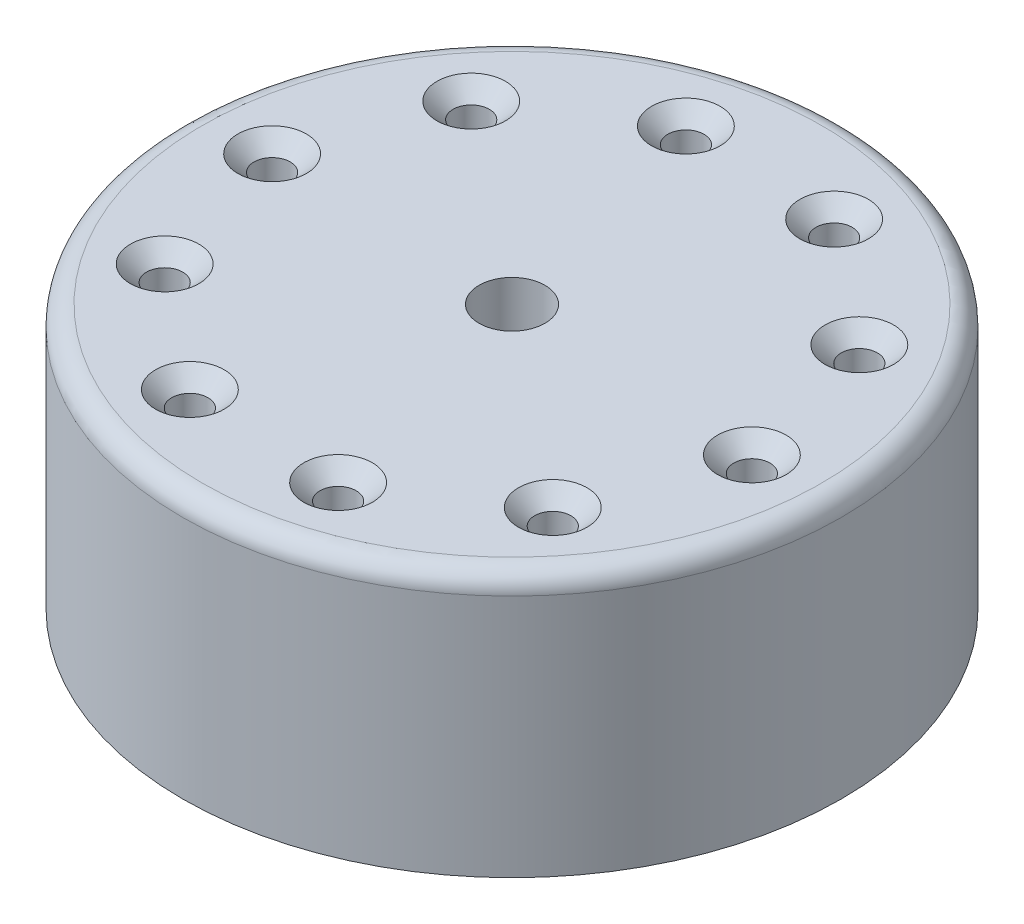
from build123d import *

# Parameters (mm, degrees)
SKETCH1_R           = 50
BOSS_EXTRUDE1_DEPTH = 40
CIRPATTERN1_COUNT   = 10
FILLET2_R           = 3
SKETCH9_R           = 5
CUT_EXTRUDE2_DEPTH  = 90.970332195
SKETCH10_R          = 47
SKETCH10_R_2        = 30
CUT_EXTRUDE3_DEPTH  = 15
CUT_EXTRUDE4_START  = 5
CUT_EXTRUDE4_DEPTH  = 5
CIRPATTERN2_COUNT   = 10


with BuildPart() as part:
    # Sketch1 → Boss-Extrude1 (new body)
    with BuildSketch(Plane(origin=(0, 0, 0), x_dir=(1, 0, 0), z_dir=(0, 1, 0))):
        with Locations(Location((0, 0, 0), (0, 0, 270))):
            Circle(SKETCH1_R)
    extrude(amount=BOSS_EXTRUDE1_DEPTH)

    # Sketch5 → CSK for M5 Countersunk Flat Head Screw1 (revolve, cut)
    with BuildSketch(Plane(origin=(-37.983874715, 40, -1.585807891), x_dir=(0, 0, 1), z_dir=(1, 0, 0))):
        Polygon((0, 0), (0, 16.652366702), (2.75, 15), (2.75, 2.45), (5.2, 0), align=None)
    csk_for_m5_countersunk_flat_head_screw1 = revolve(axis=Axis((-37.983874715, 46.35, -1.585807891), (0, -1, 0)), mode=Mode.SUBTRACT)

    # CirPattern1: CSK for M5 Countersunk Flat Head Screw1 ×10 about axis
    cirpattern1_axis = Axis((0, 0, 0), (0, 1, 0))
    for i in range(1, CIRPATTERN1_COUNT):
        add(csk_for_m5_countersunk_flat_head_screw1.rotate(cirpattern1_axis, i * 360 / CIRPATTERN1_COUNT), mode=Mode.SUBTRACT)

    # Fillet2
    fillet2_edges = [part.edges().sort_by_distance(p)[0] for p in [
        (0, 40, -50),
    ]]
    fillet(fillet2_edges, radius=FILLET2_R)

    # Sketch8 → Revolve2 (revolve)
    with BuildSketch(Plane(origin=(0, 0, 0), x_dir=(0, 0, -1), z_dir=(1, 0, 0))):
        with BuildLine():
            Line((-50, 0), (0, 0))
            Line((0, 0), (0, -15.629674134))
            ThreePointArc((0, -15.629674134), (-25.977086096, -10.940577527), (-50, 0))
        make_face()
    revolve(axis=Axis((0, 0, 0), (0, -1, 0)))

    # Sketch9 → Cut-Extrude2 (cut, through all)
    with BuildSketch(Plane(origin=(0, 40, 0), x_dir=(1, 0, 0), z_dir=(0, 1, 0))):
        with Locations(Location((0, 0, 0), (0, 0, 270))):
            Circle(SKETCH9_R)
    extrude(amount=-CUT_EXTRUDE2_DEPTH, mode=Mode.SUBTRACT)

    # Sketch10 → Cut-Extrude3 (cut)
    with BuildSketch(Plane(origin=(0, 25, 0), x_dir=(1, 0, 0), z_dir=(0, 1, 0))):
        with Locations(Location((0, 0, 0), (0, 0, 270))):
            Circle(SKETCH10_R)
        with Locations(Location((0, 0, 0), (0, 0, 270))):
            Circle(SKETCH10_R_2, mode=Mode.SUBTRACT)
    extrude(amount=-CUT_EXTRUDE3_DEPTH, mode=Mode.SUBTRACT)

    # Sketch15 → Cut-Extrude4 (cut)
    with BuildSketch(Plane(origin=(0, 10, 0), x_dir=(1, 0, 0), z_dir=(0, 1, 0)).offset(CUT_EXTRUDE4_START)):
        with BuildLine():
            Line((4.527076374, -2.122635039), (25.067176095, -16.504967699))
            ThreePointArc((25.067176095, -16.504967699), (24.302227971, -17.611899153), (23.488435591, -18.683433026))
            Line((23.488435591, -18.683433026), (3.470823887, -3.599080653))
            ThreePointArc((3.470823887, -3.599080653), (4.066518789, -2.909196615), (4.527076374, -2.122635039))
        make_face()
    cut_extrude4 = extrude(amount=-CUT_EXTRUDE4_DEPTH, mode=Mode.SUBTRACT)

    # CirPattern2: Cut-Extrude4 ×10 about axis
    cirpattern2_axis = Axis((0, 0, 0), (0, 1, 0))
    for i in range(1, CIRPATTERN2_COUNT):
        add(cut_extrude4.rotate(cirpattern2_axis, i * 360 / CIRPATTERN2_COUNT), mode=Mode.SUBTRACT)


solid = part.part
